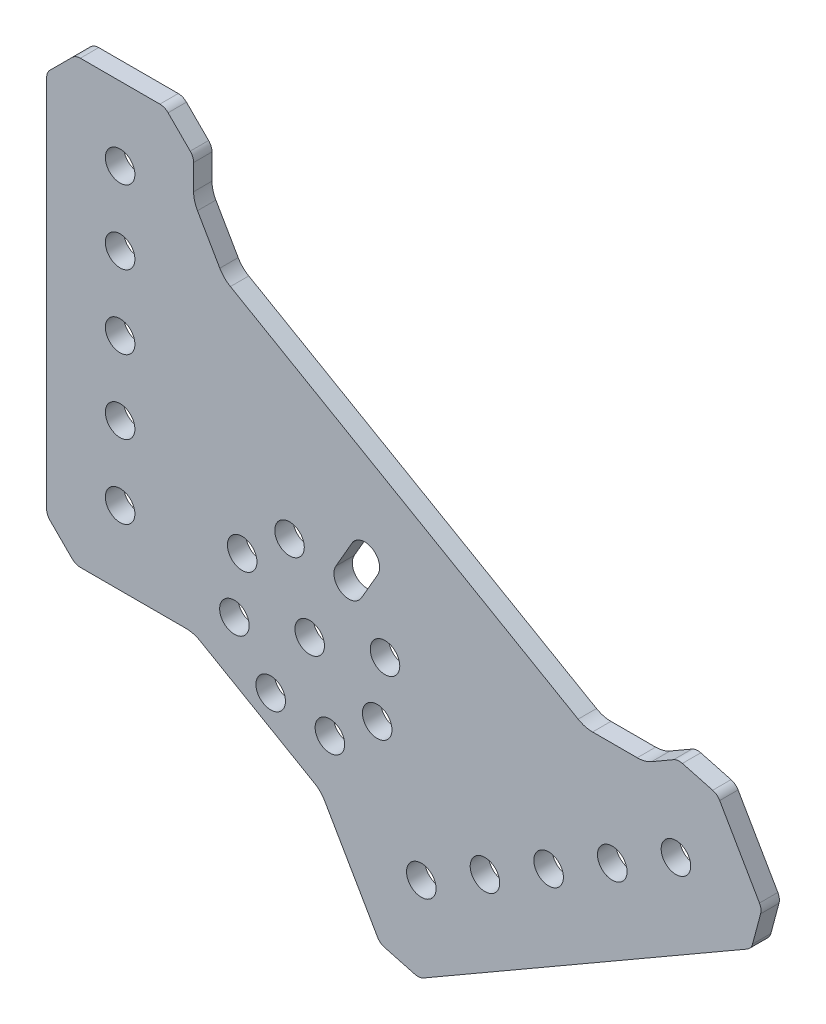
from build123d import *

# Parameters (mm, degrees)
SKETCH1_R           = 2.5527
BOSS_EXTRUDE1_DEPTH = 3.175


with BuildPart() as part:
    # Sketch1 → Boss-Extrude1 (new body)
    with BuildSketch(Plane(origin=(0, 0, 0), x_dir=(-1, 0, 0), z_dir=(0, 0, -1))):
        with BuildLine():
            Line((-4.414213562, 0.585786438), (-0.585786438, 4.414213562))
            ThreePointArc((-0.585786438, 4.414213562), (-0.152240935, 5.06306026), (0, 5.828427125))
            Line((0, 5.828427125), (0, 70.371572875))
            ThreePointArc((0, 70.371572875), (-0.152240935, 71.13693974), (-0.585786438, 71.785786438))
            Line((-0.585786438, 71.785786438), (-4.414213562, 75.614213562))
            ThreePointArc((-4.414213562, 75.614213562), (-5.06306026, 76.047759065), (-5.828427125, 76.2))
            Line((-5.828427125, 76.2), (-19.571572875, 76.2))
            ThreePointArc((-19.571572875, 76.2), (-20.33693974, 76.047759065), (-20.985786438, 75.614213562))
            Line((-20.985786438, 75.614213562), (-24.814213562, 71.785786438))
            ThreePointArc((-24.814213562, 71.785786438), (-25.247759065, 71.13693974), (-25.4, 70.371572875))
            Line((-25.4, 70.371572875), (-25.4, 65.998533312))
            ThreePointArc((-25.4, 65.998533312), (-25.570370869, 64.704438086), (-26.069872981, 63.498533312))
            Line((-26.069872981, 63.498533312), (-29.926279442, 56.819041388))
            ThreePointArc((-29.926279442, 56.819041388), (-30.720872555, 55.783507482), (-31.756406461, 54.988914369))
            Line((-31.756406461, 54.988914369), (-91.840638796, 20.299266656))
            ThreePointArc((-91.840638796, 20.299266656), (-93.04654357, 19.799764543), (-94.340638796, 19.629393675))
            Line((-94.340638796, 19.629393675), (-102.053451717, 19.629393675))
            ThreePointArc((-102.053451717, 19.629393675), (-103.347546942, 19.799764543), (-104.553451717, 20.299266656))
            Line((-104.553451717, 20.299266656), (-108.34061507, 22.485786438))
            ThreePointArc((-108.34061507, 22.485786438), (-109.079562686, 22.736625353), (-109.858253161, 22.685587283))
            Line((-109.858253161, 22.685587283), (-115.08798187, 21.284285698))
            ThreePointArc((-115.08798187, 21.284285698), (-115.787866637, 20.939140726), (-116.302394587, 20.352434046))
            Line((-116.302394587, 20.352434046), (-123.173967462, 8.450520698))
            ThreePointArc((-123.173967462, 8.450520698), (-123.424806377, 7.711573082), (-123.373768307, 6.932882608))
            Line((-123.373768307, 6.932882608), (-121.972466723, 1.703153899))
            ThreePointArc((-121.972466723, 1.703153899), (-121.627321751, 1.003269131), (-121.04061507, 0.488741182))
            Line((-121.04061507, 0.488741182), (-65.14461121, -31.782831694))
            ThreePointArc((-65.14461121, -31.782831694), (-64.405663595, -32.033670609), (-63.62697312, -31.982632539))
            Line((-63.62697312, -31.982632539), (-58.397244411, -30.581330955))
            ThreePointArc((-58.397244411, -30.581330955), (-57.697359643, -30.236185983), (-57.182831694, -29.649479302))
            Line((-57.182831694, -29.649479302), (-48.066918237, -13.860254038))
            ThreePointArc((-48.066918237, -13.860254038), (-47.272325124, -12.824720132), (-46.236791218, -12.030127019))
            Line((-46.236791218, -12.030127019), (-26.560254038, -0.669872981))
            ThreePointArc((-26.560254038, -0.669872981), (-25.354349263, -0.170370869), (-24.060254038, 0))
            Line((-24.060254038, 0), (-5.828427125, 0))
            ThreePointArc((-5.828427125, 0), (-5.06306026, 0.152240935), (-4.414213562, 0.585786438))
        make_face()
        with Locations(Location((-33.792281133, 16.076625677, 0), (0, 0, 180))):
            Circle(SKETCH1_R, mode=Mode.SUBTRACT)
        with Locations(Location((-57.123670933, 2.606241495, 0), (0, 0, 180))):
            Circle(SKETCH1_R, mode=Mode.SUBTRACT)
        with Locations(Location((-32.446584062, 5.855041615, 0), (0, 0, 180))):
            Circle(SKETCH1_R, mode=Mode.SUBTRACT)
        with Locations(Location((-48.944368004, -3.669958385, 0), (0, 0, 180))):
            Circle(SKETCH1_R, mode=Mode.SUBTRACT)
        with Locations(Location((-12.7, 12.7, 0), (0, 0, 180))):
            Circle(SKETCH1_R, mode=Mode.SUBTRACT)
        with Locations(Location((-12.7, 38.1, 0), (0, 0, 180))):
            Circle(SKETCH1_R, mode=Mode.SUBTRACT)
        with Locations(Location((-12.7, 63.5, 0), (0, 0, 180))):
            Circle(SKETCH1_R, mode=Mode.SUBTRACT)
        with Locations(Location((-64.745567884, -17.348522628, 0), (0, 0, 180))):
            Circle(SKETCH1_R, mode=Mode.SUBTRACT)
        with Locations(Location((-86.74261314, -4.648522628, 0), (0, 0, 180))):
            Circle(SKETCH1_R, mode=Mode.SUBTRACT)
        with Locations(Location((-108.739658396, 8.051477372, 0), (0, 0, 180))):
            Circle(SKETCH1_R, mode=Mode.SUBTRACT)
        with Locations(Location((-12.7, 25.4, 0), (0, 0, 180))):
            Circle(SKETCH1_R, mode=Mode.SUBTRACT)
        with Locations(Location((-12.7, 50.8, 0), (0, 0, 180))):
            Circle(SKETCH1_R, mode=Mode.SUBTRACT)
        with Locations(Location((-75.744090512, -10.998522628, 0), (0, 0, 180))):
            Circle(SKETCH1_R, mode=Mode.SUBTRACT)
        with Locations(Location((-97.741135768, 1.701477372, 0), (0, 0, 180))):
            Circle(SKETCH1_R, mode=Mode.SUBTRACT)
        with Locations(Location((-41.971584062, 22.352825557, 0), (0, 0, 180))):
            Circle(SKETCH1_R, mode=Mode.SUBTRACT)
        with Locations(Location((-58.469368004, 12.827825557, 0), (0, 0, 180))):
            Circle(SKETCH1_R, mode=Mode.SUBTRACT)
        with Locations(Location((-45.457976033, 9.341433586, 0), (0, 0, 180))):
            Circle(SKETCH1_R, mode=Mode.SUBTRACT)
        with Locations(Location((-38.722783942, -2.324261314, 0), (0, 0, 180))):
            Circle(SKETCH1_R, mode=Mode.SUBTRACT)
        with BuildLine():
            Line((-54.403871172, 19.730778486), (-57.193679081, 24.562867528))
            ThreePointArc((-57.193679081, 24.562867528), (-56.259326033, 28.049920576), (-52.772272985, 27.115567528))
            Line((-52.772272985, 27.115567528), (-49.982465075, 22.283478486))
            ThreePointArc((-49.982465075, 22.283478486), (-50.916818124, 18.796425438), (-54.403871172, 19.730778486))
        make_face(mode=Mode.SUBTRACT)
    extrude(amount=-BOSS_EXTRUDE1_DEPTH)


solid = part.part
